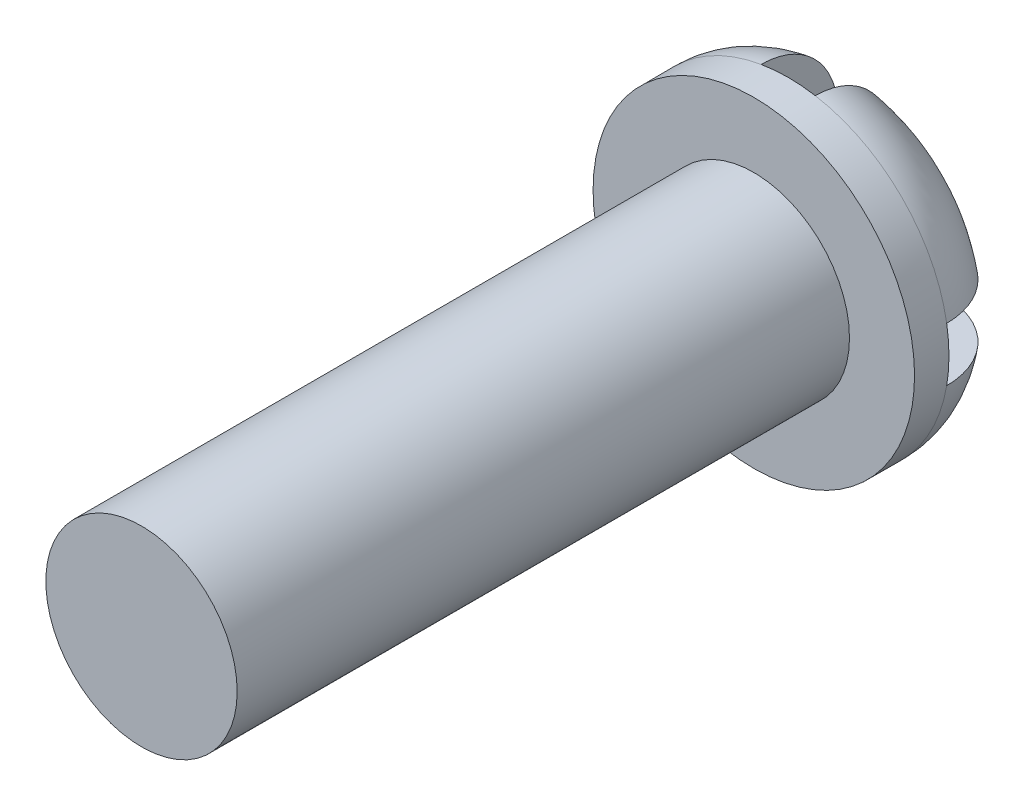
from build123d import *

# Parameters (mm, degrees)
SKETCH_1_R          = 2.5
EXTRUDE_1_DEPTH     = 16
SKETCH_2_R          = 4.2
EXTRUDE_2_DEPTH     = 2.9
FILLET_1_R          = 2
CUT_EXTRUDE_1_DEPTH = 2


with BuildPart() as part:
    # 草图1 → 凸台-拉伸1 (new body)
    with BuildSketch(Plane.XY):
        Circle(SKETCH_1_R)
    extrude(amount=EXTRUDE_1_DEPTH)

    # 草图2 → 凸台-拉伸2 (add)
    with BuildSketch(Plane(origin=(0, 0, 0), x_dir=(-1, 0, 0), z_dir=(0, 0, -1))):
        Circle(SKETCH_2_R)
    extrude(amount=EXTRUDE_2_DEPTH)

    # 圆角1
    fillet_1_edges = [part.edges().sort_by_distance(p)[0] for p in [
        (4.2, 0, -2.9),
    ]]
    fillet(fillet_1_edges, radius=FILLET_1_R)

    # 草图3 → 切除-拉伸1 (cut)
    with BuildSketch(Plane(origin=(0, 0, -2.9), x_dir=(-1, 0, 0), z_dir=(0, 0, -1))):
        Polygon((-0.707106781, 0.707106781), (-0.707106781, 6.006401657), (0.707106781, 6.006401657), (0.707106781, 0.707106781), (6.006401657, 0.707106781), (6.006401657, -0.707106781), (0.707106781, -0.707106781), (0.707106781, -6.006401657), (-0.707106781, -6.006401657), (-0.707106781, -0.707106781), (-6.006401657, -0.707106781), (-6.006401657, 0.707106781), align=None)
    extrude(amount=-CUT_EXTRUDE_1_DEPTH, mode=Mode.SUBTRACT)


solid = part.part
